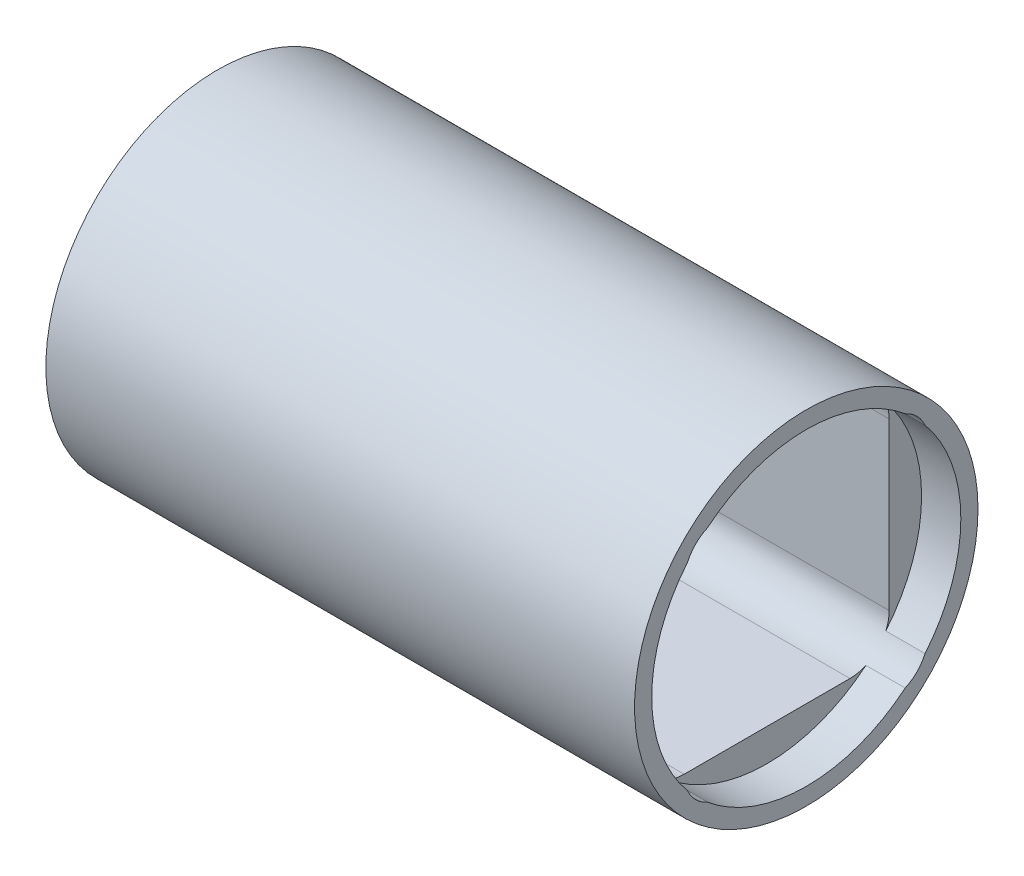
from build123d import *

# Parameters (mm, degrees)
SKETCH1_W               = 60
SKETCH1_H               = 17.5
SKETCH3_R               = 15.75
CUT_EXTRUDE1_DEPTH      = 4
CUT_EXTRUDE2_DEPTH      = 25
CUT_EXTRUDE2_DEPTH_BACK = 25
SKETCH5_R               = 6
CUT_EXTRUDE3_DEPTH      = 65.903774929
SKETCH6_W               = 4
SKETCH6_H               = 4
CUT_EXTRUDE5_DEPTH      = 65.903774929


with BuildPart() as part:
    # Sketch1 → Revolve1 (revolve)
    with BuildSketch(Plane.XY, mode=Mode.PRIVATE) as revolve1_sk:
        with Locations((30, 8.75)):
            Rectangle(SKETCH1_W, SKETCH1_H)
    revolve(revolve1_sk.sketch.rotate(Axis((0, 0, 0), (-1, 0, 0)), 90), axis=Axis((0, 0, 0), (-1, 0, 0)))

    # Sketch3 → Cut-Extrude1 (cut)
    with BuildSketch(Plane(origin=(60, 0, 0), x_dir=(0, 0, -1), z_dir=(1, 0, 0))):
        Circle(SKETCH3_R)
    extrude(amount=-CUT_EXTRUDE1_DEPTH, mode=Mode.SUBTRACT)

    # Sketch4 → Cut-Extrude2 (cut, two sides: drawn at the far end of the back side and taken through both)
    with BuildSketch(Plane(origin=(56, 0, 0), x_dir=(0, 0, -1), z_dir=(1, 0, 0)).offset(-CUT_EXTRUDE2_DEPTH_BACK)):
        with BuildLine():
            Line((-8.45, 12.45), (8.45, 12.45))
            ThreePointArc((8.45, 12.45), (11.278427125, 11.278427125), (12.45, 8.45))
            Line((12.45, 8.45), (12.45, -8.45))
            ThreePointArc((12.45, -8.45), (11.278427125, -11.278427125), (8.45, -12.45))
            Line((8.45, -12.45), (-8.45, -12.45))
            ThreePointArc((-8.45, -12.45), (-11.278427125, -11.278427125), (-12.45, -8.45))
            Line((-12.45, -8.45), (-12.45, 8.45))
            ThreePointArc((-12.45, 8.45), (-11.278427125, 11.278427125), (-8.45, 12.45))
        make_face()
    extrude(amount=CUT_EXTRUDE2_DEPTH + CUT_EXTRUDE2_DEPTH_BACK, mode=Mode.SUBTRACT)

    # Sketch5 → Cut-Extrude3 (cut, through all)
    with BuildSketch(Plane.ZY):
        Circle(SKETCH5_R)
    extrude(amount=-CUT_EXTRUDE3_DEPTH, mode=Mode.SUBTRACT)

    # Sketch6 → Cut-Extrude5 (cut, through all)
    with BuildSketch(Plane.ZY):
        with Locations((0, 6)):
            Rectangle(SKETCH6_W, SKETCH6_H)
    extrude(amount=-CUT_EXTRUDE5_DEPTH, mode=Mode.SUBTRACT)


solid = part.part
